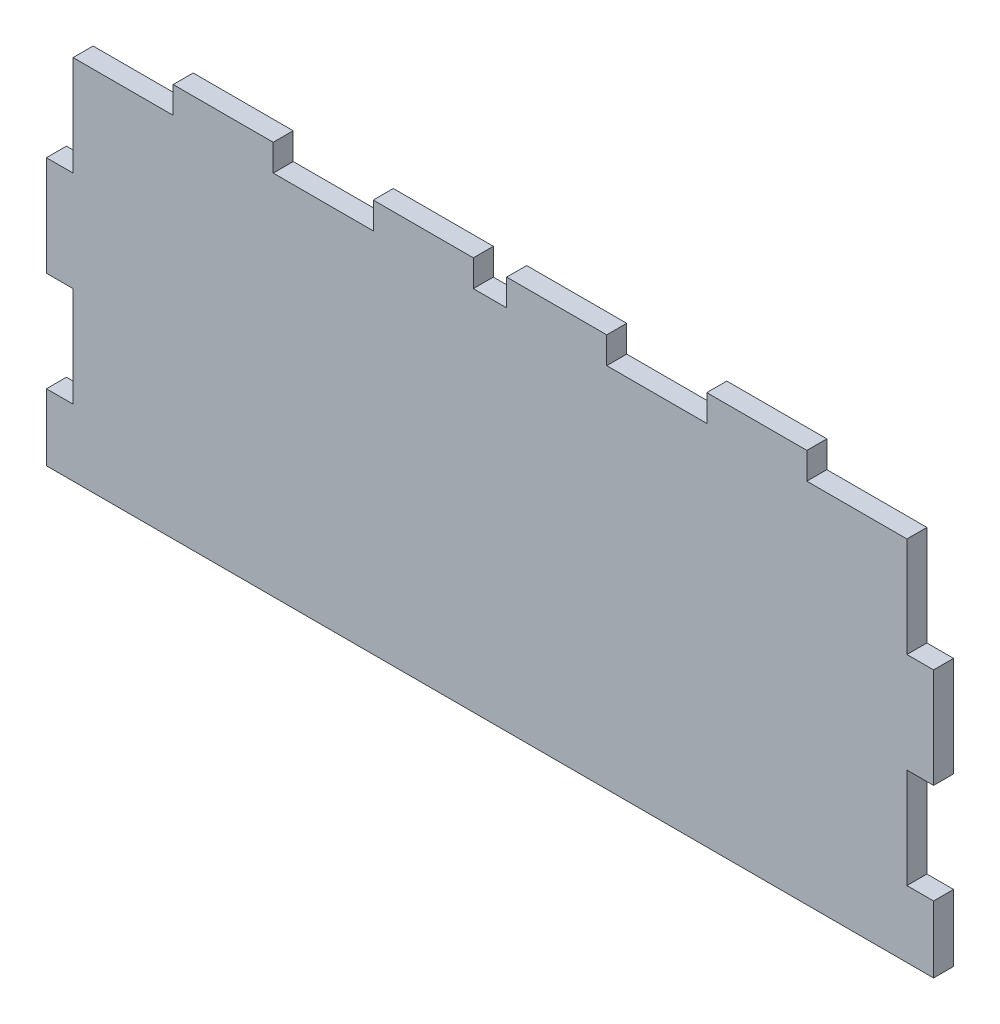
from build123d import *

# Parameters (mm, degrees)
SKETCH1_W           = 125
SKETCH1_H           = 55
BOSS_EXTRUDE1_DEPTH = 3
SKETCH2_W           = 4
SKETCH2_H           = 10
SKETCH2_H_2         = 15
SKETCH2_W_2         = 15
SKETCH2_H_3         = 4
BOSS_EXTRUDE2_DEPTH = 3


with BuildPart() as part:
    # Sketch1 → Boss-Extrude1 (new body)
    with BuildSketch(Plane.XY):
        with Locations((-62.5, 27.5)):
            Rectangle(SKETCH1_W, SKETCH1_H)
    extrude(amount=BOSS_EXTRUDE1_DEPTH)

    # Sketch2 → Boss-Extrude2 (add)
    with BuildSketch(Plane.XY.offset(3)):
        with Locations((-127, 5)):
            Rectangle(SKETCH2_W, SKETCH2_H)
        with Locations((2, 5)):
            Rectangle(SKETCH2_W, SKETCH2_H)
        with Locations((2, 32.5)):
            Rectangle(SKETCH2_W, SKETCH2_H_2)
        with Locations((-127, 32.5)):
            Rectangle(SKETCH2_W, SKETCH2_H_2)
        with Locations((-72.5, 57)):
            Rectangle(SKETCH2_W_2, SKETCH2_H_3)
        with Locations((-22.5, 57)):
            Rectangle(SKETCH2_W_2, SKETCH2_H_3)
        with Locations((-102.5, 57)):
            Rectangle(SKETCH2_W_2, SKETCH2_H_3)
        with Locations((-52.5, 57)):
            Rectangle(SKETCH2_W_2, SKETCH2_H_3)
    extrude(amount=-BOSS_EXTRUDE2_DEPTH)


solid = part.part
